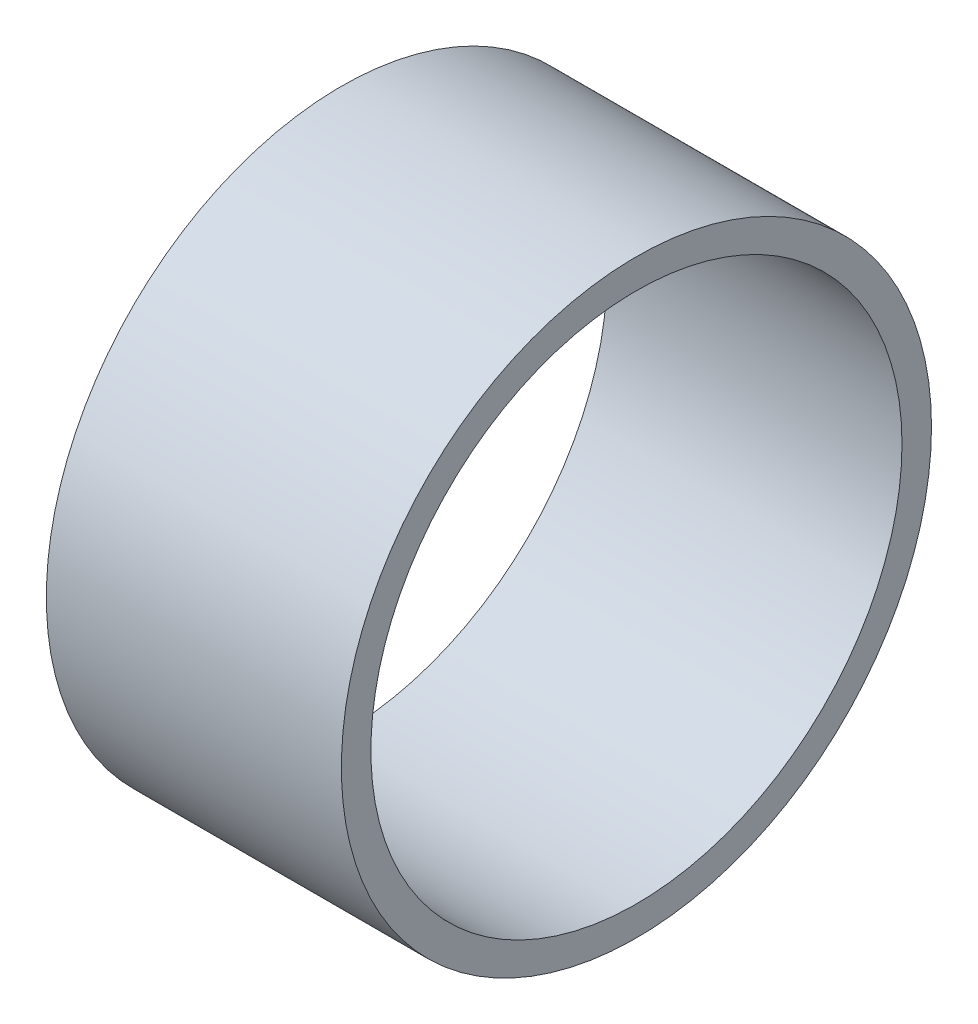
from build123d import *

# Parameters (mm, degrees)
ESQUISSE1_R        = 100
ESQUISSE1_R_2      = 90
BOSS_EXTRU_1_DEPTH = 100


with BuildPart() as part:
    # Esquisse1 → Boss.-Extru.1 (new body)
    with BuildSketch(Plane(origin=(0, 0, 0), x_dir=(0, 0, -1), z_dir=(1, 0, 0))):
        Circle(ESQUISSE1_R)
        Circle(ESQUISSE1_R_2, mode=Mode.SUBTRACT)
    extrude(amount=BOSS_EXTRU_1_DEPTH)


solid = part.part
